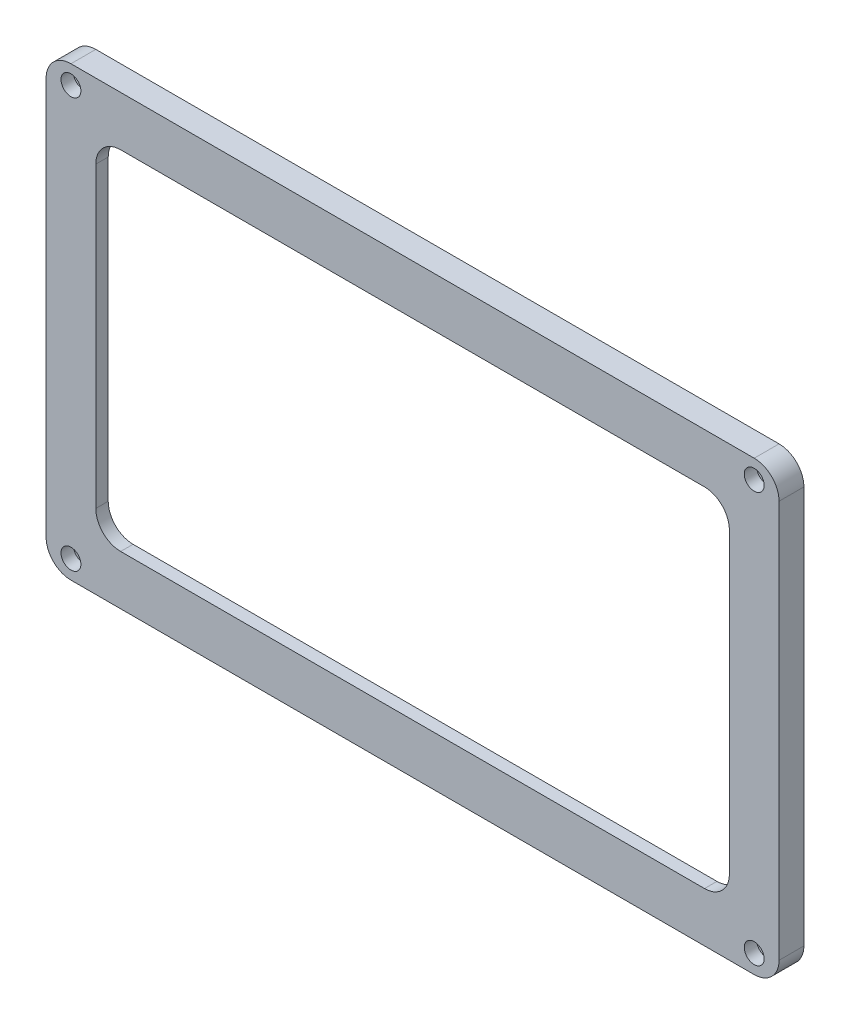
from build123d import *

# Parameters (mm, degrees)
SKETCH_1_W          = 59
SKETCH_1_H          = 36
EXTRUDE_1_DEPTH     = 3
SKETCH_2_W          = 53.5
SKETCH_2_H          = 30.5
CUT_EXTRUDE_1_DEPTH = 2
SKETCH_3_W          = 51
SKETCH_3_H          = 28
CUT_EXTRUDE_2_DEPTH = 2
FILLET_1_R          = 2
SKETCH_4_W          = 64.091292054
SKETCH_4_H          = 36.06269528
CUT_EXTRUDE_3_DEPTH = 1
FILLET_2_R          = 0.2
SKETCH_5_R          = 0.8
CUT_EXTRUDE_4_DEPTH = 1
SKETCH_6_R          = 0.6
CUT_EXTRUDE_5_DEPTH = 20.5


with BuildPart() as part:
    # 草图1 → 凸台-拉伸1 (new body)
    with BuildSketch(Plane.XY):
        Rectangle(SKETCH_1_W, SKETCH_1_H)
    extrude(amount=EXTRUDE_1_DEPTH)

    # 草图2 → 切除-拉伸1 (cut)
    with BuildSketch(Plane(origin=(0, 0, 0), x_dir=(-1, 0, 0), z_dir=(0, 0, -1))):
        Rectangle(SKETCH_2_W, SKETCH_2_H)
    extrude(amount=-CUT_EXTRUDE_1_DEPTH, mode=Mode.SUBTRACT)

    # 草图3 → 切除-拉伸2 (cut)
    with BuildSketch(Plane.XY.offset(3)):
        Rectangle(SKETCH_3_W, SKETCH_3_H)
    extrude(amount=-CUT_EXTRUDE_2_DEPTH, mode=Mode.SUBTRACT)

    # 圆角1
    fillet_1_edges = [part.edges().sort_by_distance(p)[0] for p in [
        (25.5, 14, 2.5),
        (25.5, -14, 2.5),
        (-25.5, -14, 2.5),
        (-25.5, 14, 2.5),
        (29.5, -18, 1.5),
        (-29.5, -18, 1.5),
        (-29.5, 18, 1.5),
        (29.5, 18, 1.5),
    ]]
    fillet(fillet_1_edges, radius=FILLET_1_R)

    # 草图4 → 切除-拉伸3 (cut)
    with BuildSketch(Plane(origin=(0, 0, 0), x_dir=(-1, 0, 0), z_dir=(0, 0, -1))):
        Rectangle(SKETCH_4_W, SKETCH_4_H)
    extrude(amount=-CUT_EXTRUDE_3_DEPTH, mode=Mode.SUBTRACT)

    # 圆角2
    fillet_2_edges = [part.edges().sort_by_distance(p)[0] for p in [
        (-26.75, 15.25, 1.5),
        (-26.75, -15.25, 1.5),
        (26.75, -15.25, 1.5),
        (26.75, 15.25, 1.5),
    ]]
    fillet(fillet_2_edges, radius=FILLET_2_R)

    # 草图5 → 切除-拉伸4 (cut)
    with BuildSketch(Plane.XY.offset(3)):
        with Locations((-27.5, 16.5)):
            Circle(SKETCH_5_R)
        with Locations((27.5, 16.5)):
            Circle(SKETCH_5_R)
        with Locations((27.5, -16.5)):
            Circle(SKETCH_5_R)
        with Locations((-27.5, -16.5)):
            Circle(SKETCH_5_R)
    extrude(amount=-CUT_EXTRUDE_4_DEPTH, mode=Mode.SUBTRACT)

    # 草图6 → 切除-拉伸5 (cut)
    with BuildSketch(Plane.XY.offset(2)):
        with Locations((-27.5, 16.5)):
            Circle(SKETCH_6_R)
        with Locations((27.5, 16.5)):
            Circle(SKETCH_6_R)
        with Locations((27.5, -16.5)):
            Circle(SKETCH_6_R)
        with Locations((-27.5, -16.5)):
            Circle(SKETCH_6_R)
    extrude(amount=-CUT_EXTRUDE_5_DEPTH, mode=Mode.SUBTRACT)


solid = part.part
